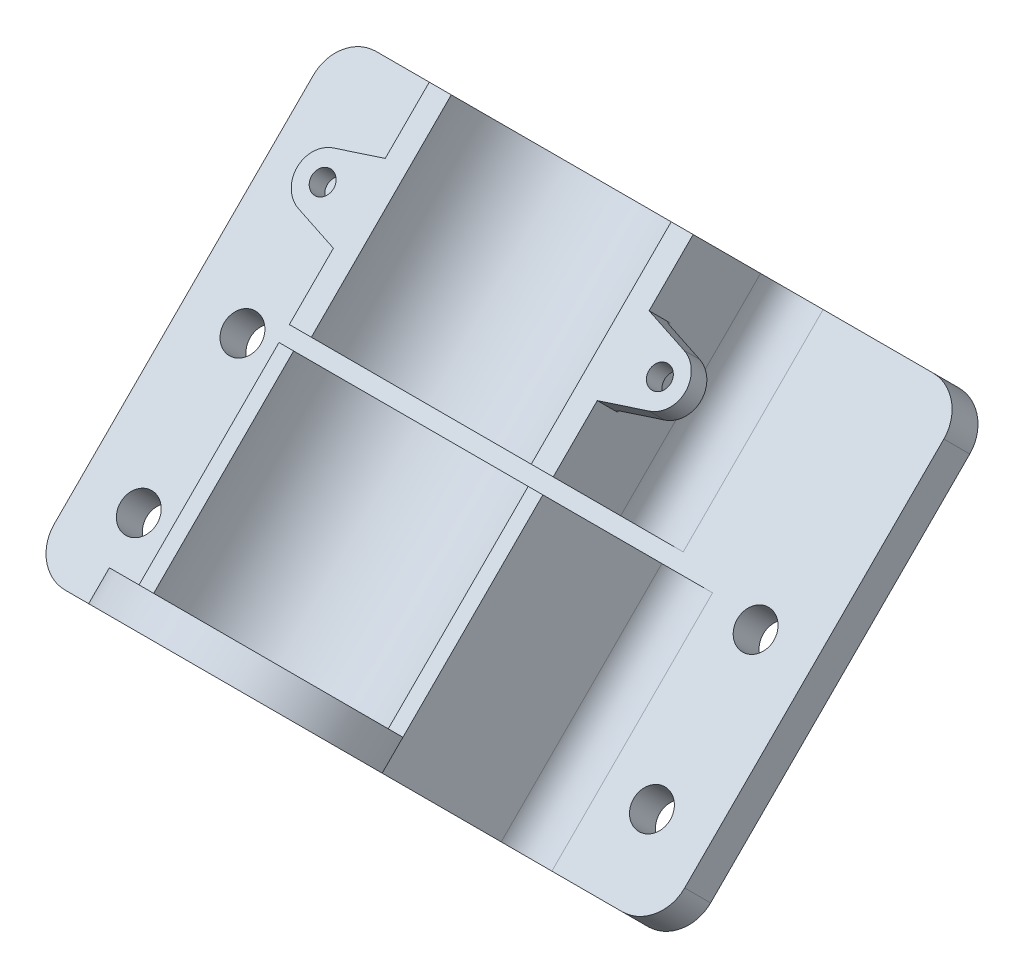
from build123d import *

# Parameters (mm, degrees)
SKETCH1_R           = 18
BOSS_EXTRUDE1_DEPTH = 4
CUT_EXTRUDE1_REACH  = 178.366
SKETCH2_R           = 1.5
BOSS_EXTRUDE2_START = 27
BOSS_EXTRUDE2_DEPTH = 27
SKETCH4_W           = 86
SKETCH4_H           = 60
BOSS_EXTRUDE5_DEPTH = 5
BOSS_EXTRUDE6_START = -31
BOSS_EXTRUDE6_DEPTH = 31
BOSS_EXTRUDE7_DEPTH = 27
SKETCH9_R           = 1.5
BOSS_EXTRUDE8_DEPTH = 3
FILLET2_R           = 5
FILLET3_R           = 1
CUT_EXTRUDE2_REACH  = 157.453
SKETCH10_R          = 2.5


with BuildPart() as part:
    # Sketch1 → Boss-Extrude1 (new body)
    with BuildSketch(Plane(origin=(0, 24.62645802, -24.62645802), x_dir=(1, 0, 0), z_dir=(2.4702462297909737e-15, -0.70710678118655, 0.707106781186545))):
        with Locations(Location((73.844609768, 130.551114539, 0), (0, 0, 90))):
            Circle(SKETCH1_R)
        with BuildLine():
            Line((83.2907778, 127.269360509), (77.126363797, 121.104946506))
            ThreePointArc((77.126363797, 121.104946506), (66.773541956, 123.480046727), (64.398441736, 133.832868568))
            Line((64.398441736, 133.832868568), (70.562855738, 139.997282571))
            ThreePointArc((70.562855738, 139.997282571), (80.91567758, 137.62218235), (83.2907778, 127.269360509))
        make_face(mode=Mode.SUBTRACT)
    extrude(amount=BOSS_EXTRUDE1_DEPTH)

    # Sketch2 → Cut-Extrude1 (cut, up to next)
    with BuildSketch(Plane(origin=(0, 24.62645802, -24.62645802), x_dir=(1, 0, 0), z_dir=(-2.4702462297909737e-15, 0.70710678118655, -0.707106781186545)), mode=Mode.PRIVATE) as cut_extrude1_sk1:
        with Locations(Location((86.844609768, -130.551114539, 0), (0, 0, 270))):
            Circle(SKETCH2_R)
    cut_extrude1_tool1 = extrude(cut_extrude1_sk1.sketch, amount=-CUT_EXTRUDE1_REACH, mode=Mode.PRIVATE) & part.part
    # Sketch2 → Cut-Extrude1 (cut, up to next)
    with BuildSketch(Plane(origin=(0, 24.62645802, -24.62645802), x_dir=(1, 0, 0), z_dir=(-2.4702462297909737e-15, 0.70710678118655, -0.707106781186545)), mode=Mode.PRIVATE) as cut_extrude1_sk2:
        with Locations(Location((73.844609768, -143.551114539, 0), (0, 0, 270))):
            Circle(SKETCH2_R)
    cut_extrude1_tool2 = extrude(cut_extrude1_sk2.sketch, amount=-CUT_EXTRUDE1_REACH, mode=Mode.PRIVATE) & part.part
    # Sketch2 → Cut-Extrude1 (cut, up to next)
    with BuildSketch(Plane(origin=(0, 24.62645802, -24.62645802), x_dir=(1, 0, 0), z_dir=(-2.4702462297909737e-15, 0.70710678118655, -0.707106781186545)), mode=Mode.PRIVATE) as cut_extrude1_sk3:
        with Locations(Location((60.844609768, -130.551114539, 0), (0, 0, 270))):
            Circle(SKETCH2_R)
    cut_extrude1_tool3 = extrude(cut_extrude1_sk3.sketch, amount=-CUT_EXTRUDE1_REACH, mode=Mode.PRIVATE) & part.part
    # Sketch2 → Cut-Extrude1 (cut, up to next)
    with BuildSketch(Plane(origin=(0, 24.62645802, -24.62645802), x_dir=(1, 0, 0), z_dir=(-2.4702462297909737e-15, 0.70710678118655, -0.707106781186545)), mode=Mode.PRIVATE) as cut_extrude1_sk4:
        with Locations(Location((73.844609768, -117.551114539, 0), (0, 0, 270))):
            Circle(SKETCH2_R)
    cut_extrude1_tool4 = extrude(cut_extrude1_sk4.sketch, amount=-CUT_EXTRUDE1_REACH, mode=Mode.PRIVATE) & part.part
    add(cut_extrude1_tool1.solids().sort_by_distance((86.84461, 116.940036, 67.68712))[0], mode=Mode.SUBTRACT)
    add(cut_extrude1_tool2.solids().sort_by_distance((73.84461, 126.132425, 76.879509))[0], mode=Mode.SUBTRACT)
    add(cut_extrude1_tool3.solids().sort_by_distance((60.84461, 116.940036, 67.68712))[0], mode=Mode.SUBTRACT)
    add(cut_extrude1_tool4.solids().sort_by_distance((73.84461, 107.747648, 58.494732))[0], mode=Mode.SUBTRACT)

    # Sketch3 → Boss-Extrude2 (add)
    with BuildSketch(Plane(origin=(0, 24.62645802, -24.62645802), x_dir=(1, 0, 0), z_dir=(-2.4702462297909737e-15, 0.70710678118655, -0.707106781186545)).offset(BOSS_EXTRUDE2_START)):
        with BuildLine():
            Line((91.844609768, -130.551114539), (89.844609768, -130.551114539))
            ThreePointArc((89.844609768, -130.551114539), (73.844609768, -114.551114539), (57.844609768, -130.551114539))
            Line((57.844609768, -130.551114539), (55.844609768, -130.551114539))
            ThreePointArc((55.844609768, -130.551114539), (73.844609768, -112.551114539), (91.844609768, -130.551114539))
        make_face()
    extrude(amount=-BOSS_EXTRUDE2_DEPTH)



with BuildPart() as body_2:
    # Sketch4 → Boss-Extrude5 (new body)
    with BuildSketch(Plane(origin=(0, 79.58565632, 79.58565632), x_dir=(-1, 0, 0), z_dir=(0, -0.7071067811865451, -0.70710678118655))):
        with Locations((-73.844609768, 60.827070924)):
            Rectangle(SKETCH4_W, SKETCH4_H)
    extrude(amount=BOSS_EXTRUDE5_DEPTH)


with BuildPart() as part_1:
    add(part.part)

    add(body_2.part)  # Boss-Extrude6 merges body 2
    # Sketch6 → Boss-Extrude6 (add)
    with BuildSketch(Plane(origin=(0, 21.798030895, -21.798030895), x_dir=(1, 0, 0), z_dir=(2.4702462297909737e-15, -0.70710678118655, 0.707106781186545)).offset(BOSS_EXTRUDE6_START)):
        with BuildLine():
            ThreePointArc((73.844609768, 112.551114539), (61.116687706, 117.823192477), (55.844609768, 130.551114539))
            Line((55.844609768, 130.551114539), (48.844609768, 112.551114539))
            Line((48.844609768, 112.551114539), (73.844609768, 112.551114539))
        make_face()
        with BuildLine():
            Line((57.844609768, 130.551114539), (55.844609768, 130.551114539))
            ThreePointArc((55.844609768, 130.551114539), (61.116687706, 117.823192477), (73.844609768, 112.551114539))
            ThreePointArc((73.844609768, 112.551114539), (86.572531829, 117.823192477), (91.844609768, 130.551114539))
            Line((91.844609768, 130.551114539), (89.844609768, 130.551114539))
            ThreePointArc((89.844609768, 130.551114539), (73.844609768, 114.551114539), (57.844609768, 130.551114539))
        make_face()
        with BuildLine():
            ThreePointArc((91.844609768, 130.551114539), (86.572531829, 117.823192477), (73.844609768, 112.551114539))
            Line((73.844609768, 112.551114539), (98.844609768, 112.551114539))
            Line((98.844609768, 112.551114539), (91.844609768, 130.551114539))
        make_face()
    extrude(amount=BOSS_EXTRUDE6_DEPTH)

    # Sketch8 → Boss-Extrude7 (add)
    with BuildSketch(Plane(origin=(0, 64.224437766, -64.224437766), x_dir=(1, 0, 0), z_dir=(0, 0.7071067811865498, -0.7071067811865452))):
        with BuildLine():
            Line((91.844609768, -130.551114539), (88.844609768, -130.551114539))
            ThreePointArc((88.844609768, -130.551114539), (73.844609768, -115.551114539), (58.844609768, -130.551114539))
            Line((58.844609768, -130.551114539), (55.844609768, -130.551114539))
            Line((55.844609768, -130.551114539), (55.844609768, -112.551114539))
            Line((55.844609768, -112.551114539), (91.844609768, -112.551114539))
            Line((91.844609768, -112.551114539), (91.844609768, -130.551114539))
        make_face()
    extrude(amount=-BOSS_EXTRUDE7_DEPTH)

    # Sketch9 → Boss-Extrude8 (add)
    # profile 1 of 2: a face of its own
    with BuildSketch(Plane(origin=(0, 92.313578382, 92.313578382), x_dir=(1, 0, 0), z_dir=(-6.542051911181989e-15, 0.7071067811865454, 0.7071067811865497))):
        with BuildLine():
            Line((55.844609768, 72.327070924), (49.919173765, 73.951634922))
            ThreePointArc((49.919173765, 73.951634922), (47.344609768, 77.327070924), (49.919173765, 80.702506927))
            Line((49.919173765, 80.702506927), (55.844609768, 82.327070924))
            Line((55.844609768, 82.327070924), (55.844609768, 72.327070924))
        make_face()
        with Locations(Location((50.844609768, 77.327070924, 0), (0, 0, 270))):
            Circle(SKETCH9_R, mode=Mode.SUBTRACT)
    # profile 2 of 2: a face of its own
    with BuildSketch(Plane(origin=(0, 92.313578382, 92.313578382), x_dir=(1, 0, 0), z_dir=(-6.542051911181989e-15, 0.7071067811865454, 0.7071067811865497))):
        with BuildLine():
            Line((97.77004577, 80.702506927), (91.844609768, 82.327070924))
            Line((91.844609768, 82.327070924), (91.844609768, 72.327070924))
            Line((91.844609768, 72.327070924), (97.77004577, 73.951634922))
            ThreePointArc((97.77004577, 73.951634922), (100.344609768, 77.327070924), (97.77004577, 80.702506927))
        make_face()
        with Locations(Location((96.844609768, 77.327070924, 0), (0, 0, 270))):
            Circle(SKETCH9_R, mode=Mode.SUBTRACT)
    extrude(amount=-BOSS_EXTRUDE8_DEPTH)

    # Fillet2
    fillet2_edges = [part_1.edges().sort_by_distance(p)[0] for p in [
        (98.844609768, 112.343842324, 46.827470317),
        (48.844609768, 112.343842324, 46.827470317),
        (30.844609768, 99.615920262, 56.019858473),
        (30.844609768, 142.042327133, 13.593451601),
        (116.844609768, 142.042327133, 13.593451601),
        (116.844609768, 99.615920262, 56.019858473),
        (91.844609768, 134.26415254, 24.9071601),
        (55.844609768, 134.26415254, 24.9071601),
    ]]
    fillet(fillet2_edges, radius=FILLET2_R)

    # Fillet3
    fillet3_edges = [part_1.edges().sort_by_distance(p)[0] for p in [
        (55.844609768, 144.870754258, 35.513761818),
        (91.844609768, 144.870754258, 35.513761818),
    ]]
    fillet(fillet3_edges, radius=FILLET3_R)

    # Sketch10 → Cut-Extrude2 (cut, up to next)
    with BuildSketch(Plane(origin=(0, 79.58565632, 79.58565632), x_dir=(1, 0, 0), z_dir=(0, 0.7071067811865451, 0.70710678118655)), mode=Mode.PRIVATE) as cut_extrude2_sk1:
        with Locations(Location((108.844609768, 40.827070924, 0), (0, 0, 270))):
            Circle(SKETCH10_R)
    cut_extrude2_tool1 = extrude(cut_extrude2_sk1.sketch, amount=-CUT_EXTRUDE2_REACH, mode=Mode.PRIVATE) & part_1.part
    # Sketch10 → Cut-Extrude2 (cut, up to next)
    with BuildSketch(Plane(origin=(0, 79.58565632, 79.58565632), x_dir=(1, 0, 0), z_dir=(0, 0.7071067811865451, 0.70710678118655)), mode=Mode.PRIVATE) as cut_extrude2_sk2:
        with Locations(Location((38.844609768, 40.827070924, 0), (0, 0, 270))):
            Circle(SKETCH10_R)
    cut_extrude2_tool2 = extrude(cut_extrude2_sk2.sketch, amount=-CUT_EXTRUDE2_REACH, mode=Mode.PRIVATE) & part_1.part
    # Sketch10 → Cut-Extrude2 (cut, up to next)
    with BuildSketch(Plane(origin=(0, 79.58565632, 79.58565632), x_dir=(1, 0, 0), z_dir=(0, 0.7071067811865451, 0.70710678118655)), mode=Mode.PRIVATE) as cut_extrude2_sk3:
        with Locations(Location((108.844609768, 60.827070924, 0), (0, 0, 270))):
            Circle(SKETCH10_R)
    cut_extrude2_tool3 = extrude(cut_extrude2_sk3.sketch, amount=-CUT_EXTRUDE2_REACH, mode=Mode.PRIVATE) & part_1.part
    # Sketch10 → Cut-Extrude2 (cut, up to next)
    with BuildSketch(Plane(origin=(0, 79.58565632, 79.58565632), x_dir=(1, 0, 0), z_dir=(0, 0.7071067811865451, 0.70710678118655)), mode=Mode.PRIVATE) as cut_extrude2_sk4:
        with Locations(Location((38.844609768, 60.827070924, 0), (0, 0, 270))):
            Circle(SKETCH10_R)
    cut_extrude2_tool4 = extrude(cut_extrude2_sk4.sketch, amount=-CUT_EXTRUDE2_REACH, mode=Mode.PRIVATE) & part_1.part
    add(cut_extrude2_tool1.solids().sort_by_distance((108.84461, 108.454755, 50.716558))[0], mode=Mode.SUBTRACT)
    add(cut_extrude2_tool2.solids().sort_by_distance((38.84461, 108.454755, 50.716558))[0], mode=Mode.SUBTRACT)
    add(cut_extrude2_tool3.solids().sort_by_distance((108.84461, 122.596891, 36.574422))[0], mode=Mode.SUBTRACT)
    add(cut_extrude2_tool4.solids().sort_by_distance((38.84461, 122.596891, 36.574422))[0], mode=Mode.SUBTRACT)


solid = part_1.part
